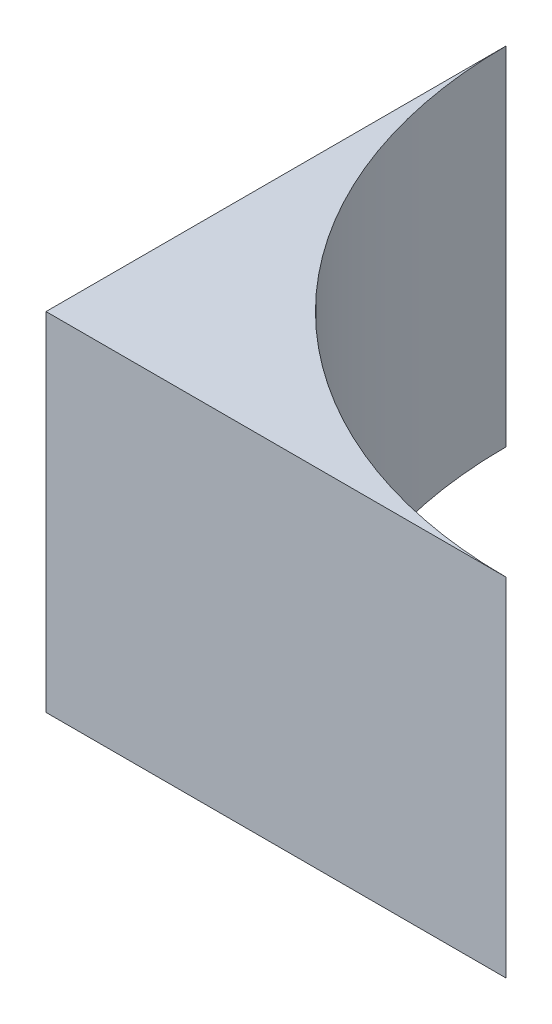
from build123d import *

# Parameters (mm, degrees)
BOSS_EXTRUDE1_DEPTH = 48.5


with BuildPart() as part:
    # Sketch2 → Boss-Extrude1 (new body)
    with BuildSketch(Plane(origin=(0, 0, 0), x_dir=(1, 0, 0), z_dir=(0, 1, 0))):
        with BuildLine():
            Line((0, -64.25), (-64.25, -64.25))
            Line((-64.25, -64.25), (-64.25, 0))
            ThreePointArc((-64.25, 0), (-45.431610691, -45.431610691), (0, -64.25))
        make_face()
    extrude(amount=BOSS_EXTRUDE1_DEPTH)


solid = part.part
